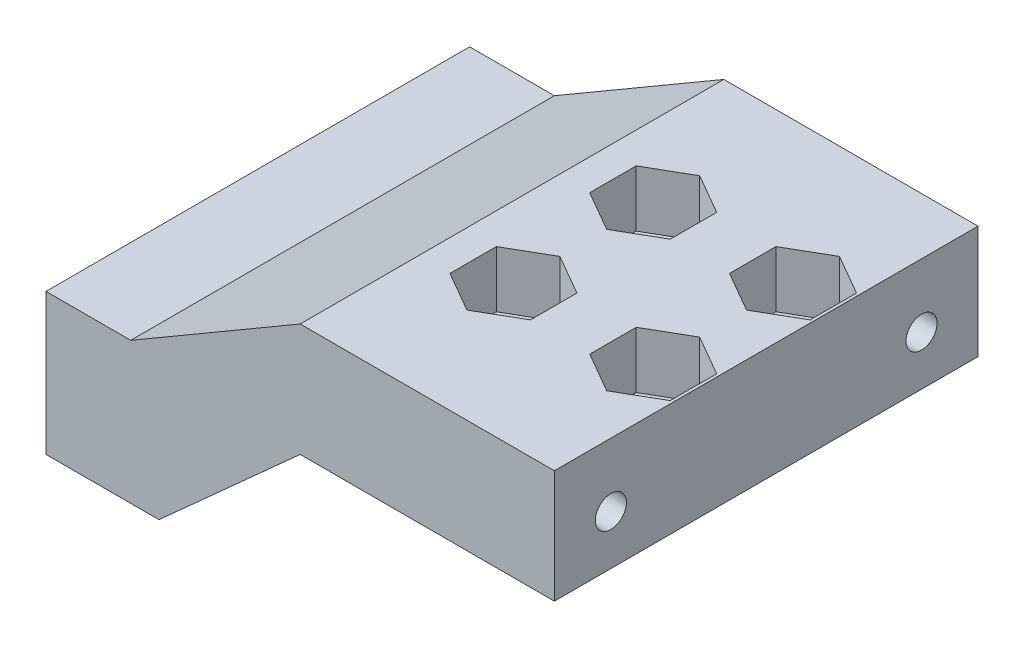
from build123d import *

# Parameters (mm, degrees)
SKETCH_1_W          = 41
SKETCH_1_H          = 30
EXTRUDE_1_DEPTH     = 10
SKETCH_3_W          = 30
SKETCH_3_H          = 10
CUT_EXTRUDE_2_DEPTH = 3
EXTRUDE_3_DEPTH     = 30
SKETCH_6_W          = 20
SKETCH_6_H          = 30
CUT_EXTRUDE_5_DEPTH = 9
SKETCH_2_R          = 1.1
CUT_EXTRUDE_1_DEPTH = 15
SKETCH_8_R          = 1.5
CUT_EXTRUDE_6_DEPTH = 52.594573358
SKETCH_4_R          = 1.1
CUT_EXTRUDE_3_DEPTH = 10
CUT_EXTRUDE_7_DEPTH = 54.572380944
CUT_EXTRUDE_8_DEPTH = 4
SKETCH_11_W         = 4.132049734
SKETCH_11_H         = 3.255839909
CUT_EXTRUDE_9_DEPTH = 54.572380944


with BuildPart() as part:
    # Эскиз1 → Бобышка-Вытянуть1 (new body)
    with BuildSketch(Plane(origin=(0, 0, 0), x_dir=(1, 0, 0), z_dir=(0, 1, 0))):
        with Locations((20.5, 15)):
            Rectangle(SKETCH_1_W, SKETCH_1_H)
    extrude(amount=EXTRUDE_1_DEPTH)

    # Эскиз3 → Вырез-Вытянуть2 (cut)
    with BuildSketch(Plane.ZY):
        with Locations((-15, 5)):
            Rectangle(SKETCH_3_W, SKETCH_3_H)
    extrude(amount=-CUT_EXTRUDE_2_DEPTH, mode=Mode.SUBTRACT)

    # Эскиз7 → Бобышка-Вытянуть3 (add)
    with BuildSketch(Plane(origin=(0, 0, -30), x_dir=(-1, 0, 0), z_dir=(0, 0, -1))):
        Polygon((-39, 17), (-21, 17), (-9, 10), (-39, 10), align=None)
    extrude(amount=-EXTRUDE_3_DEPTH)

    # Эскиз6 → Вырез-Вытянуть5 (cut)
    with BuildSketch(Plane.XZ):
        with Locations((31, -15)):
            Rectangle(SKETCH_6_W, SKETCH_6_H)
    extrude(amount=-CUT_EXTRUDE_5_DEPTH, mode=Mode.SUBTRACT)

    # Эскиз2 → Вырез-Вытянуть1 (cut)
    with BuildSketch(Plane(origin=(39, 0, 0), x_dir=(0, 0, -1), z_dir=(1, 0, 0))):
        with Locations((4, 12.5)):
            Circle(SKETCH_2_R)
        with Locations((26, 12.5)):
            Circle(SKETCH_2_R)
    extrude(amount=-CUT_EXTRUDE_1_DEPTH, mode=Mode.SUBTRACT)

    # Эскиз8 → Вырез-Вытянуть6 (cut, through all)
    with BuildSketch(Plane(origin=(0, 9, 0), x_dir=(1, 0, 0), z_dir=(0, 1, 0))):
        with Locations(Location((35.949747468, 19.949747468, 0), (0, 0, 270))):
            Circle(SKETCH_8_R)
        with Locations(Location((35.949747468, 10.050252532, 0), (0, 0, 270))):
            Circle(SKETCH_8_R)
        with Locations(Location((26.050252532, 10.050252532, 0), (0, 0, 270))):
            Circle(SKETCH_8_R)
        with Locations(Location((26.050252532, 19.949747468, 0), (0, 0, 270))):
            Circle(SKETCH_8_R)
    extrude(amount=CUT_EXTRUDE_6_DEPTH, mode=Mode.SUBTRACT)

    # Эскиз4 → Вырез-Вытянуть3 (cut)
    with BuildSketch(Plane.ZY.offset(-3)):
        with Locations((-20, 5.4)):
            Circle(SKETCH_4_R)
        with Locations((-10, 5.4)):
            Circle(SKETCH_4_R)
    extrude(amount=-CUT_EXTRUDE_3_DEPTH, mode=Mode.SUBTRACT)

    # Эскиз9 → Вырез-Вытянуть7 (cut, through all)
    with BuildSketch(Plane(origin=(0, 0, -30), x_dir=(-1, 0, 0), z_dir=(0, 0, -1))):
        Polygon((-21, 9), (-21, 0), (-11, 0), align=None)
    extrude(amount=-CUT_EXTRUDE_7_DEPTH, mode=Mode.SUBTRACT)

    # Эскиз10 → Вырез-Вытянуть8 (cut)
    with BuildSketch(Plane(origin=(0, 17, 0), x_dir=(1, 0, 0), z_dir=(0, 1, 0))):
        Polygon((26.050252532, 23.240644003), (23.200252532, 21.595195735), (23.200252532, 18.304299201), (26.050252532, 16.658850934), (28.900252532, 18.304299201), (28.900252532, 21.595195735), align=None)
        Polygon((35.949747468, 23.240644003), (33.099747468, 21.595195735), (33.099747468, 18.304299201), (35.949747468, 16.658850934), (38.799747468, 18.304299201), (38.799747468, 21.595195735), align=None)
        Polygon((35.949747468, 13.341149066), (33.099747468, 11.695700799), (33.099747468, 8.404804265), (35.949747468, 6.759355997), (38.799747468, 8.404804265), (38.799747468, 11.695700799), align=None)
        Polygon((26.050252532, 13.341149066), (23.200252532, 11.695700799), (23.200252532, 8.404804265), (26.050252532, 6.759355997), (28.900252532, 8.404804265), (28.900252532, 11.695700799), align=None)
    extrude(amount=-CUT_EXTRUDE_8_DEPTH, mode=Mode.SUBTRACT)

    # Эскиз11 → Вырез-Вытянуть9 (cut, through all)
    with BuildSketch(Plane(origin=(0, 0, -30), x_dir=(-1, 0, 0), z_dir=(0, 0, -1))):
        with Locations((-41.066024867, 8.372080046)):
            Rectangle(SKETCH_11_W, SKETCH_11_H)
    extrude(amount=-CUT_EXTRUDE_9_DEPTH, mode=Mode.SUBTRACT)


solid = part.part
